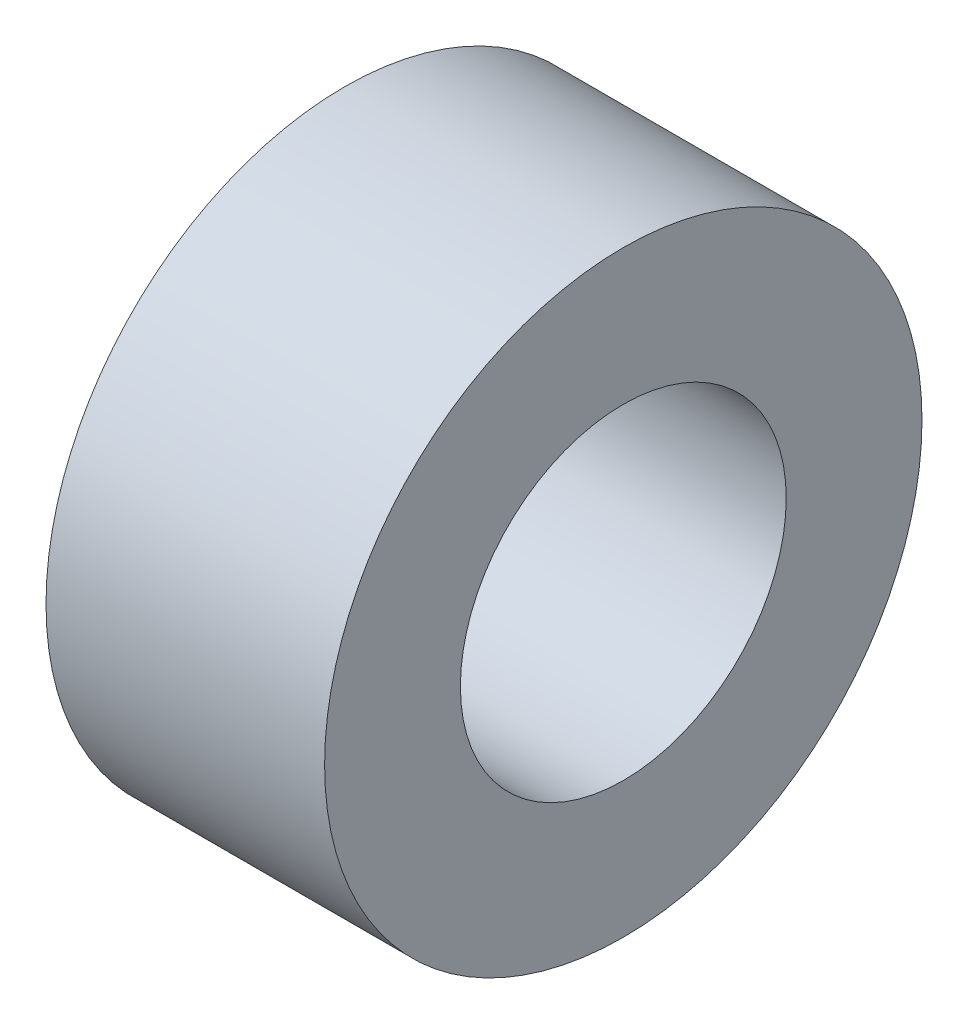
from build123d import *

# Parameters (mm, degrees)
SKETCH_1_R      = 5.5
SKETCH_1_R_2    = 3
EXTRUDE_1_DEPTH = 5.13


with BuildPart() as part:
    # 草图1 → 凸台-拉伸1 (new body)
    with BuildSketch(Plane(origin=(0, 0, 0), x_dir=(0, 0, -1), z_dir=(1, 0, 0))):
        Circle(SKETCH_1_R)
        Circle(SKETCH_1_R_2, mode=Mode.SUBTRACT)
    extrude(amount=EXTRUDE_1_DEPTH)


solid = part.part
